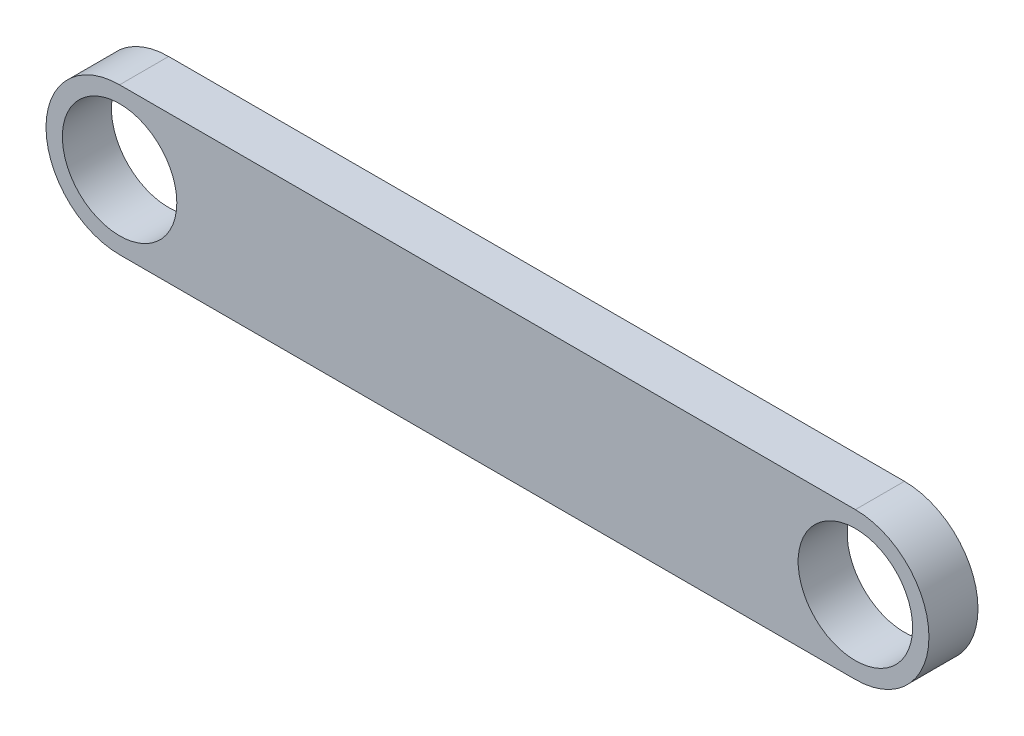
from build123d import *

# Parameters (mm, degrees)
SKETCH_1_R      = 3.5
EXTRUDE_1_DEPTH = 1.5


with BuildPart() as part:
    # 草图1 → 凸台-拉伸1 (new, symmetric)
    with BuildSketch(Plane.XY):
        with BuildLine():
            Line((45, 4.5), (0, 4.5))
            ThreePointArc((0, 4.5), (-4.5, 0), (0, -4.5))
            Line((0, -4.5), (45, -4.5))
            ThreePointArc((45, -4.5), (49.5, 0), (45, 4.5))
        make_face()
        with Locations((45, 0)):
            Circle(SKETCH_1_R, mode=Mode.SUBTRACT)
        Circle(SKETCH_1_R, mode=Mode.SUBTRACT)
    extrude(amount=EXTRUDE_1_DEPTH, both=True)


solid = part.part
